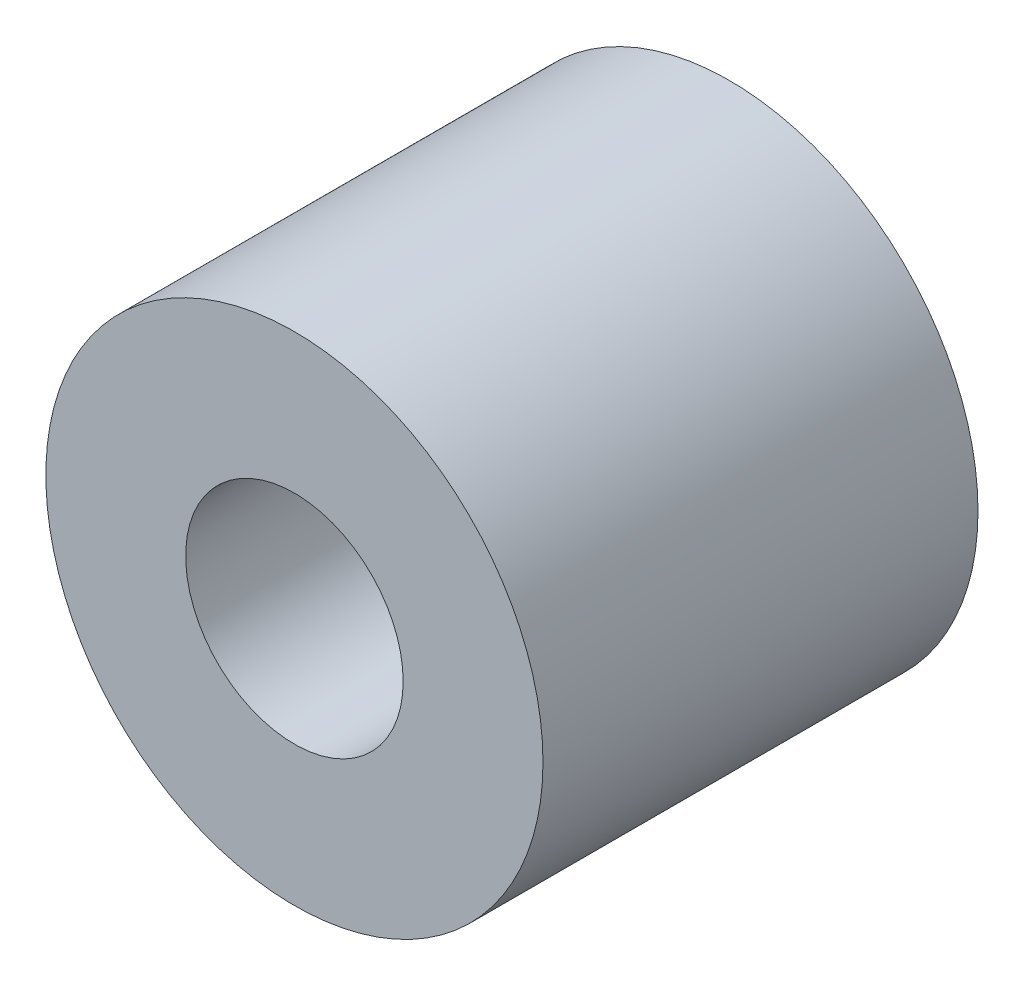
from build123d import *

# Parameters (mm, degrees)
SKETCH1_R           = 4
SKETCH1_R_2         = 1.75
BOSS_EXTRUDE1_DEPTH = 3.5


with BuildPart() as part:
    # Sketch1 → Boss-Extrude1 (new, symmetric)
    with BuildSketch(Plane.XY):
        Circle(SKETCH1_R)
        Circle(SKETCH1_R_2, mode=Mode.SUBTRACT)
    extrude(amount=BOSS_EXTRUDE1_DEPTH, both=True)


solid = part.part
